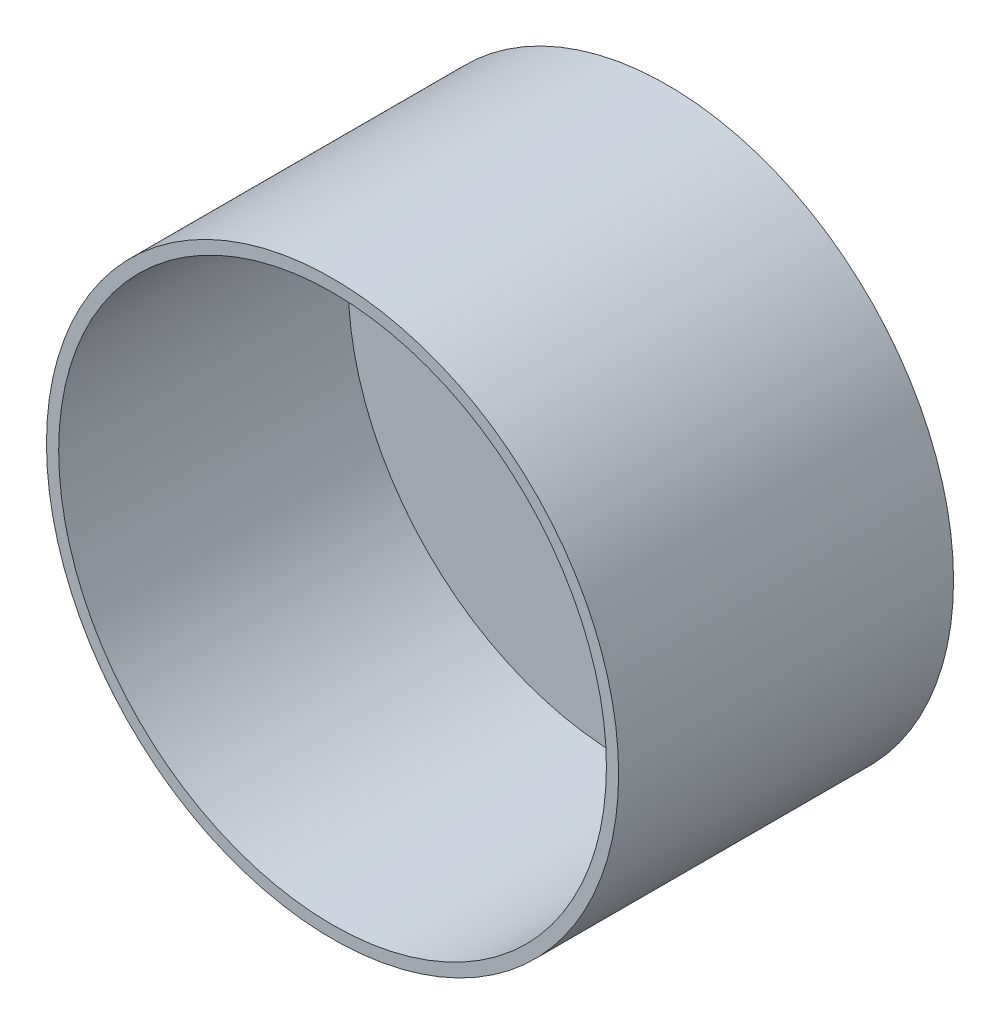
from build123d import *

# Parameters (mm, degrees)
SKETCH_1_R          = 41
EXTRUDE_1_DEPTH     = 48
SKETCH_2_R          = 39.25
CUT_EXTRUDE_1_DEPTH = 41.5


with BuildPart() as part:
    # 草图1 → 凸台-拉伸1 (new body)
    with BuildSketch(Plane.XY):
        Circle(SKETCH_1_R)
    extrude(amount=EXTRUDE_1_DEPTH)

    # 草图2 → 切除-拉伸1 (cut)
    with BuildSketch(Plane.XY.offset(48)):
        Circle(SKETCH_2_R)
    extrude(amount=-CUT_EXTRUDE_1_DEPTH, mode=Mode.SUBTRACT)


solid = part.part
